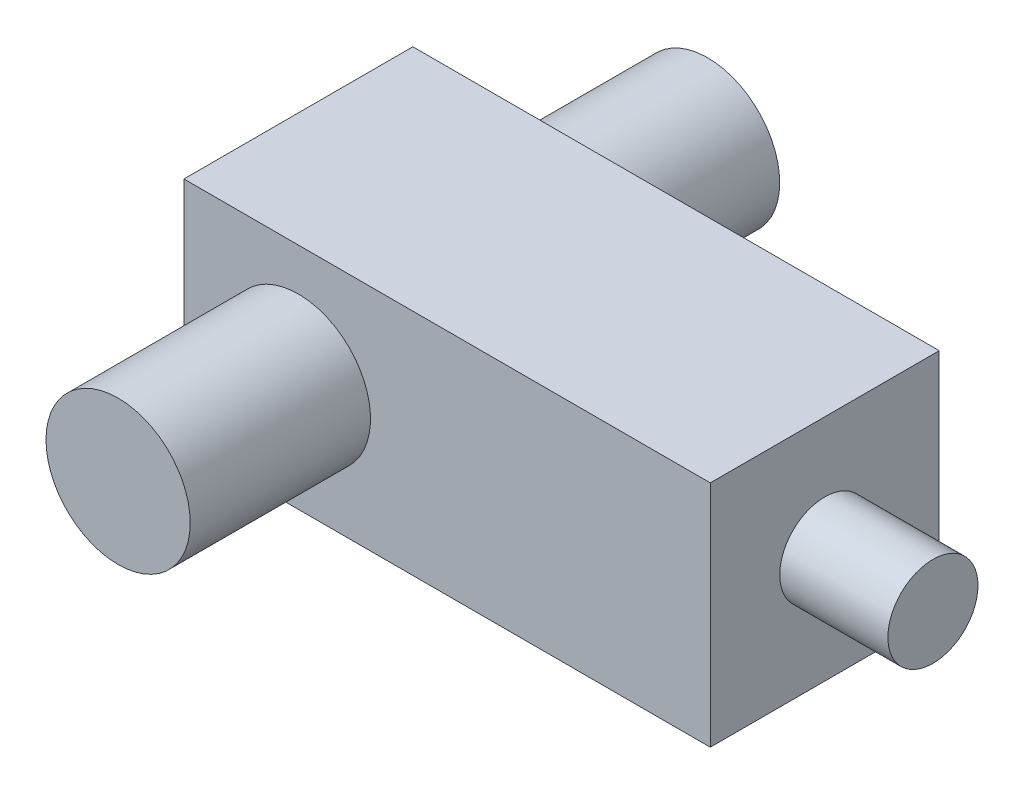
from build123d import *

# Parameters (mm, degrees)
SKETCH1_W           = 29.2
SKETCH1_H           = 12.7
BOSS_EXTRUDE1_DEPTH = 12.7
SKETCH2_R           = 4
BOSS_EXTRUDE2_DEPTH = 10
SKETCH3_R           = 2.5
BOSS_EXTRUDE3_DEPTH = 6


with BuildPart() as part:
    # Sketch1 → Boss-Extrude1 (new body)
    with BuildSketch(Plane(origin=(0, 0, 0), x_dir=(1, 0, 0), z_dir=(0, 1, 0))):
        Rectangle(SKETCH1_W, SKETCH1_H)
    extrude(amount=BOSS_EXTRUDE1_DEPTH)

    # Sketch2 → Boss-Extrude2 (add)
    with BuildSketch(Plane.XY.offset(6.35)):
        with Locations(Location((-8.25, 6.35, 0), (0, 0, 180))):
            Circle(SKETCH2_R)
    boss_extrude2 = extrude(amount=BOSS_EXTRUDE2_DEPTH)

    # Mirror1: Boss-Extrude2 across plane
    add(boss_extrude2.mirror(Plane.XY))

    # Sketch3 → Boss-Extrude3 (add)
    with BuildSketch(Plane(origin=(14.6, 0, 0), x_dir=(0, 0, -1), z_dir=(1, 0, 0))):
        with Locations((0, 6.35)):
            Circle(SKETCH3_R)
    extrude(amount=BOSS_EXTRUDE3_DEPTH)


solid = part.part
